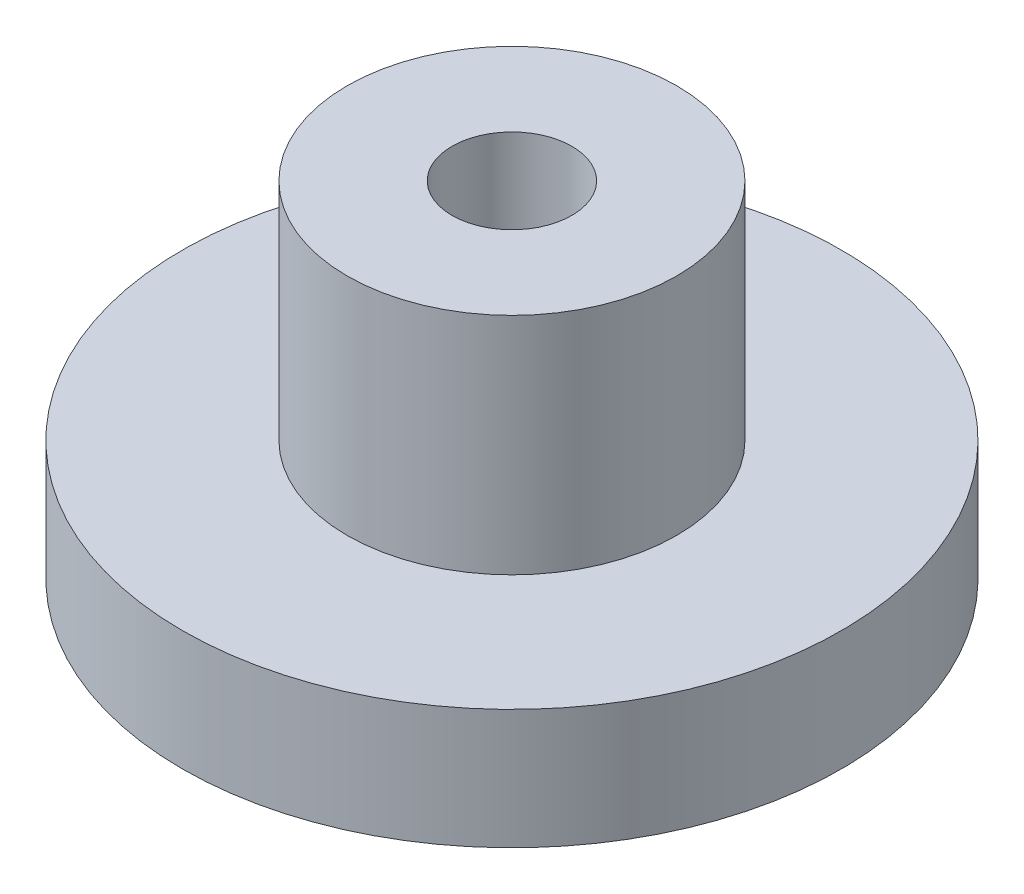
from build123d import *

# Parameters (mm, degrees)
SKETCH_1_W = 3.5
SKETCH_1_H = 7.5


with BuildPart() as part:
    # 草图1 → 旋转1 (revolve)
    with BuildSketch(Plane(origin=(0, 0, 0), x_dir=(0, 0, -1), z_dir=(1, 0, 0)), mode=Mode.PRIVATE) as revolve_1_sk:
        with Locations((3.75, -3.75)):
            Rectangle(SKETCH_1_W, SKETCH_1_H)
        Polygon((5.5, -7.5), (2, -7.5), (2, -8.9), (3.1, -8.9), (3.1, -11.5), (11, -11.5), (11, -7.5), align=None)
    revolve(revolve_1_sk.sketch.rotate(Axis((0, 0, 0), (0, -1, 0)), 180), axis=Axis((0, 0, 0), (0, -1, 0)))


solid = part.part
